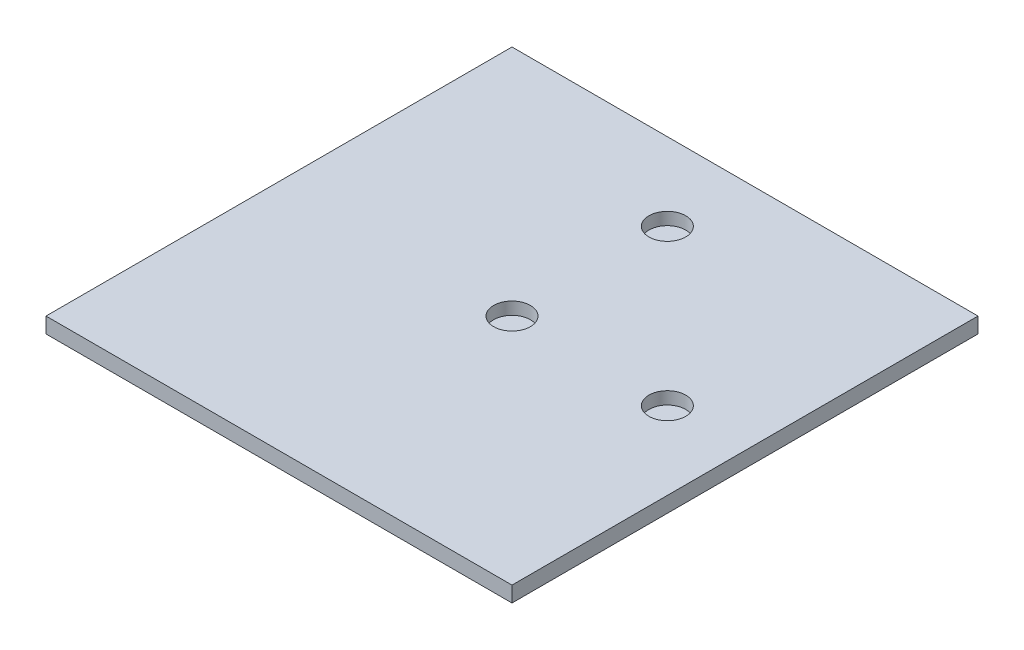
from build123d import *

# Parameters (mm, degrees)
SKETCH2_W           = 150
SKETCH2_H           = 150
BOSS_EXTRUDE1_DEPTH = 5
SKETCH5_R           = 5.925
CUT_EXTRUDE2_DEPTH  = 4


with BuildPart() as part:
    # Sketch2 → Boss-Extrude1 (new body)
    with BuildSketch(Plane(origin=(0, 0, 0), x_dir=(1, 0, 0), z_dir=(0, 1, 0))):
        Rectangle(SKETCH2_W, SKETCH2_H)
    extrude(amount=BOSS_EXTRUDE1_DEPTH)

    # Sketch5 → Cut-Extrude2 (cut)
    with BuildSketch(Plane(origin=(0, 5, 0), x_dir=(1, 0, 0), z_dir=(0, 1, 0))):
        Circle(SKETCH5_R)
        with Locations((50, 0)):
            Circle(SKETCH5_R)
        with Locations((0, 50)):
            Circle(SKETCH5_R)
    extrude(amount=-CUT_EXTRUDE2_DEPTH, mode=Mode.SUBTRACT)


solid = part.part
